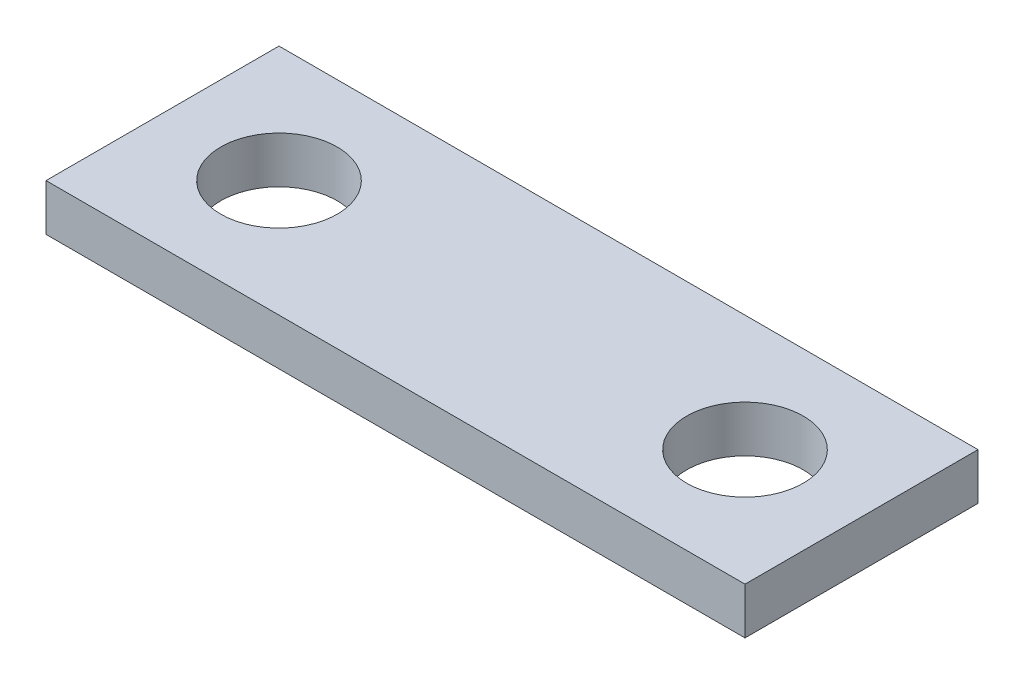
from build123d import *

# Parameters (mm, degrees)
SKETCH_1_W      = 30
SKETCH_1_H      = 10
EXTRUDE_1_DEPTH = 2


with BuildPart() as part:
    # 草图1 → 凸台-拉伸1 (new body)
    # profile 1 of 2: a face of its own
    with BuildSketch(Plane(origin=(0, 0, 0), x_dir=(1, 0, 0), z_dir=(0, 1, 0))):
        Rectangle(SKETCH_1_W, SKETCH_1_H)
        with BuildLine():
            Line((10, -2.5), (-10, -2.5))
            ThreePointArc((-10, -2.5), (-12.5, 0), (-10, 2.5))
            Line((-10, 2.5), (10, 2.5))
            ThreePointArc((10, 2.5), (11.767766953, 1.767766953), (12.5, 0))
            ThreePointArc((12.5, 0), (11.767766953, -1.767766953), (10, -2.5))
        make_face(mode=Mode.SUBTRACT)
    # profile 2 of 2: a face of its own
    with BuildSketch(Plane(origin=(0, 0, 0), x_dir=(1, 0, 0), z_dir=(0, 1, 0))):
        with BuildLine():
            ThreePointArc((-7.5, 0), (-8.232233047, -1.767766953), (-10, -2.5))
            Line((-10, -2.5), (10, -2.5))
            ThreePointArc((10, -2.5), (7.5, 0), (10, 2.5))
            Line((10, 2.5), (-10, 2.5))
            ThreePointArc((-10, 2.5), (-8.232233047, 1.767766953), (-7.5, 0))
        make_face()
    extrude(amount=EXTRUDE_1_DEPTH)


solid = part.part
